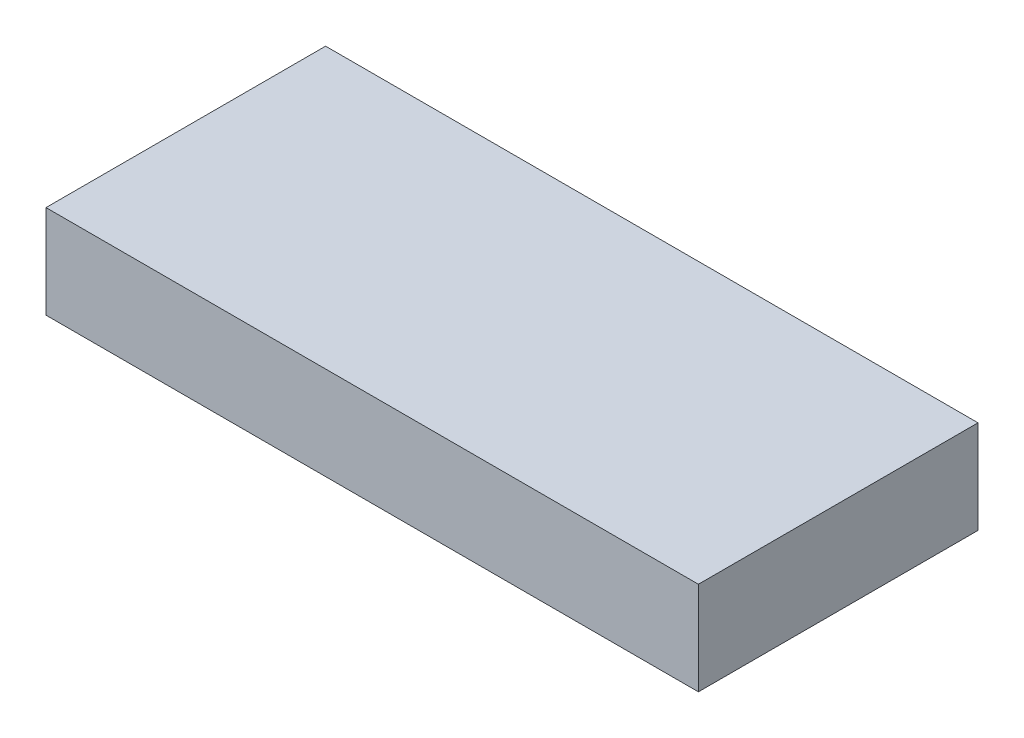
from build123d import *

# Parameters (mm, degrees)
SKETCH1_W           = 70
SKETCH1_H           = 30
BOSS_EXTRUDE1_DEPTH = 10


with BuildPart() as part:
    # Sketch1 → Boss-Extrude1 (new body)
    with BuildSketch(Plane(origin=(0, 0, 0), x_dir=(1, 0, 0), z_dir=(0, 1, 0))):
        Rectangle(SKETCH1_W, SKETCH1_H)
    extrude(amount=BOSS_EXTRUDE1_DEPTH)


solid = part.part
